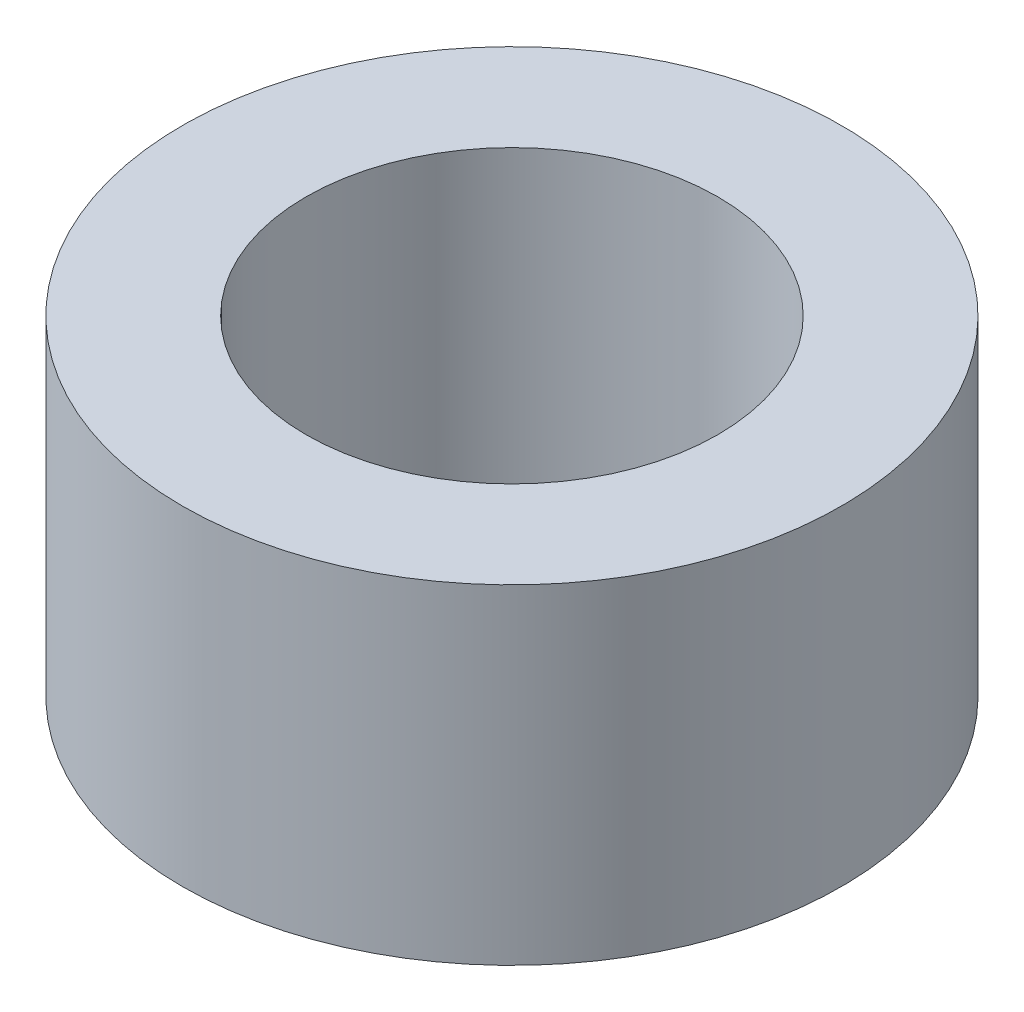
from build123d import *

# Parameters (mm, degrees)
SKETCH1_R           = 5
SKETCH1_R_2         = 3.125
BOSS_EXTRUDE1_DEPTH = 2.5


with BuildPart() as part:
    # Sketch1 → Boss-Extrude1 (new, symmetric)
    with BuildSketch(Plane(origin=(0, 0, 0), x_dir=(1, 0, 0), z_dir=(0, 1, 0))):
        with Locations(Location((0, 0, 0), (0, 0, 270))):
            Circle(SKETCH1_R)
        with Locations(Location((0, 0, 0), (0, 0, 270))):
            Circle(SKETCH1_R_2, mode=Mode.SUBTRACT)
    extrude(amount=BOSS_EXTRUDE1_DEPTH, both=True)


solid = part.part
